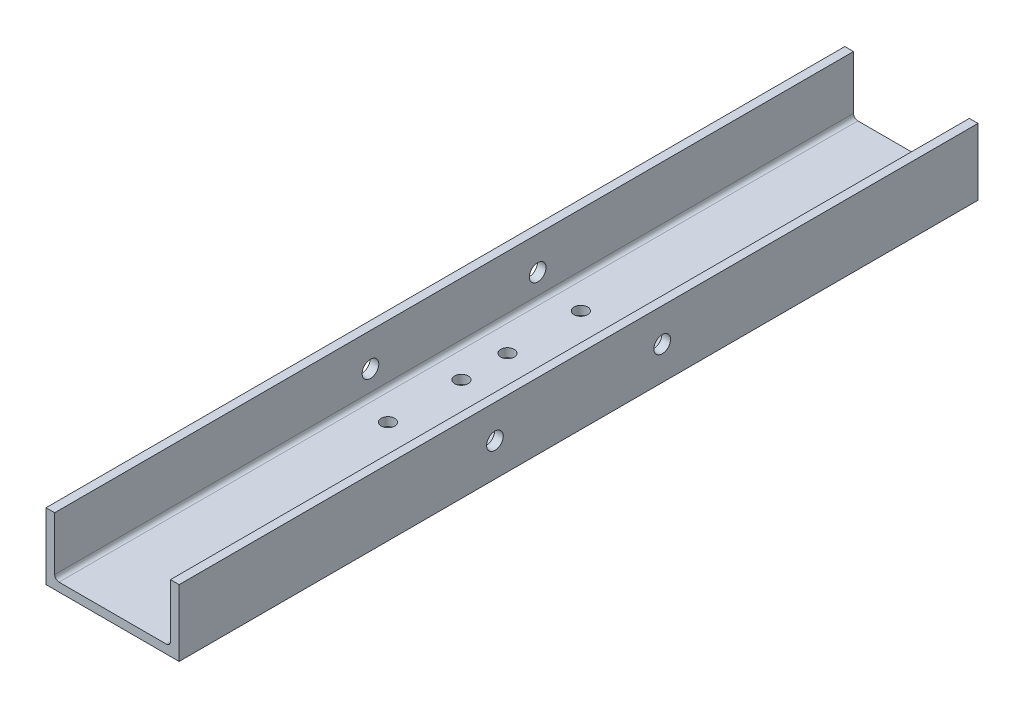
from build123d import *

# Parameters (mm, degrees)
BOSS_EXTRUDE1_DEPTH = 152.4
FILLET1_R           = 1.651
SKETCH4_R           = 2.585
CUT_EXTRUDE1_DEPTH  = 10
SKETCH9_R           = 3.18
CUT_EXTRUDE2_DEPTH  = 30


with BuildPart() as part:
    # Sketch3 → Boss-Extrude1 (new, symmetric)
    with BuildSketch(Plane.XY):
        Polygon((-25.4, 12.7), (-25.4, -12.7), (25.4, -12.7), (25.4, 12.7), (22.098, 12.7), (22.098, -9.398), (-22.098, -9.398), (-22.098, 12.7), align=None)
    extrude(amount=BOSS_EXTRUDE1_DEPTH, both=True)

    # Fillet1
    fillet1_edges = [part.edges().sort_by_distance(p)[0] for p in [
        (-22.098, -9.398, 0),
        (22.098, -9.398, 0),
    ]]
    fillet(fillet1_edges, radius=FILLET1_R)

    # Sketch4 → Cut-Extrude1 (cut)
    with BuildSketch(Plane(origin=(0, -9.398, 0), x_dir=(1, 0, 0), z_dir=(0, 1, 0))):
        with Locations(Location((-10.530435142, 8.79, 0), (0, 0, 180))):
            Circle(SKETCH4_R)
        with Locations(Location((10.469564858, 8.79, 0), (0, 0, 180))):
            Circle(SKETCH4_R)
        with Locations(Location((-10.530435142, 36.79, 0), (0, 0, 180))):
            Circle(SKETCH4_R)
        with Locations(Location((10.469564858, 36.79, 0), (0, 0, 180))):
            Circle(SKETCH4_R)
        with Locations(Location((-10.530435142, -36.79, 0), (0, 0, 180))):
            Circle(SKETCH4_R)
        with Locations(Location((10.469564858, -36.79, 0), (0, 0, 180))):
            Circle(SKETCH4_R)
        with Locations(Location((10.469564858, -8.79, 0), (0, 0, 180))):
            Circle(SKETCH4_R)
        with Locations(Location((-10.530435142, -8.79, 0), (0, 0, 180))):
            Circle(SKETCH4_R)
    extrude(amount=-CUT_EXTRUDE1_DEPTH, mode=Mode.SUBTRACT)

    # Sketch9 → Cut-Extrude2 (cut, symmetric)
    with BuildSketch(Plane(origin=(0, 0, 0), x_dir=(0, 0, -1), z_dir=(1, 0, 0))):
        with Locations(Location((-31.91, 0, 0), (0, 0, 270))):
            Circle(SKETCH9_R)
        with Locations(Location((31.91, 0, 0), (0, 0, 270))):
            Circle(SKETCH9_R)
    extrude(amount=CUT_EXTRUDE2_DEPTH, both=True, mode=Mode.SUBTRACT)


solid = part.part
